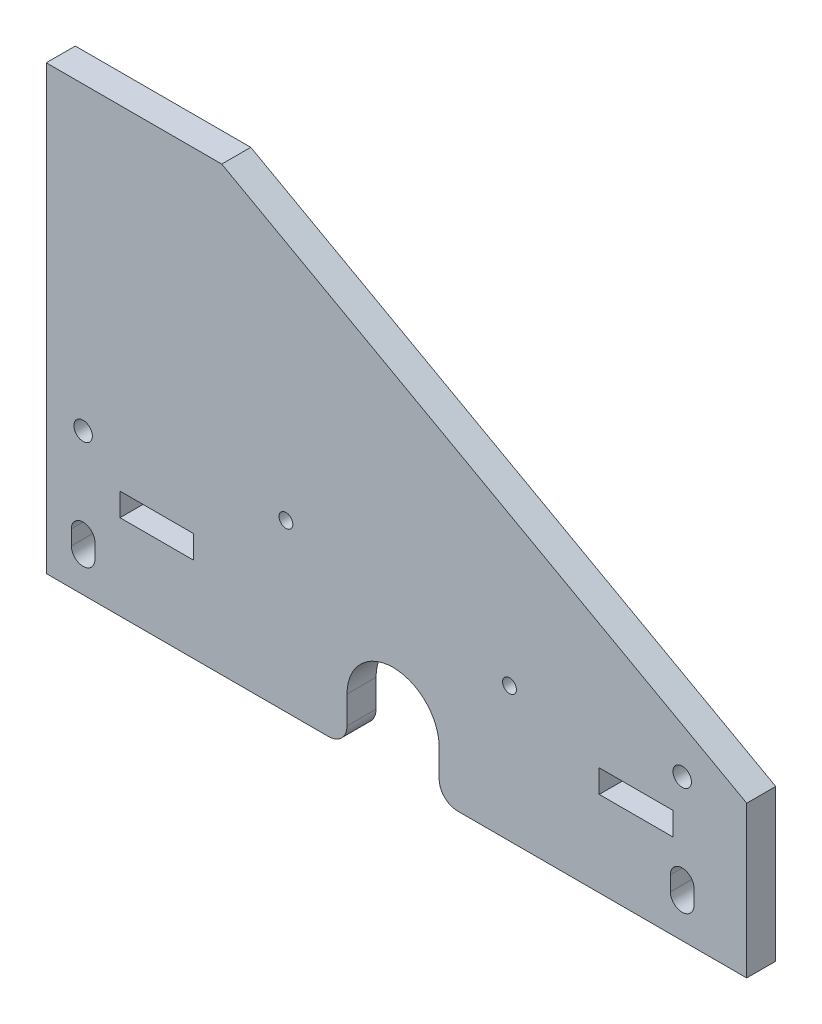
from build123d import *

# Parameters (mm, degrees)
BOSS_EXTRUDE1_DEPTH = 10
CUT_EXTRUDE1_REACH  = 241.572
SKETCH3_W           = 25.4
SKETCH3_H           = 7.9375
CUT_EXTRUDE2_REACH  = 241.572
SKETCH6_R           = 3.175
CUT_EXTRUDE3_DEPTH  = 10
SKETCH7_R           = 2.38125
CUT_EXTRUDE4_DEPTH  = 10
SKETCH8_R           = 2.38125
CUT_EXTRUDE5_DEPTH  = 10
SKETCH9_W           = 25.4
SKETCH9_H           = 7.9375
CUT_EXTRUDE6_DEPTH  = 10
LPATTERN1_COUNT     = 2
LPATTERN1_PITCH     = 206.375
LPATTERN4_COUNT     = 2
LPATTERN4_PITCH     = 206.375
CUT_EXTRUDE7_DEPTH  = 10


with BuildPart() as part:
    # Sketch1 → Boss-Extrude1 (new body)
    with BuildSketch(Plane.XY):
        Polygon((-141.926632071, 127.818083413), (38.921367929, 27.572400076), (38.921367929, -24.581916587), (-202.378632071, -24.581916587), (-202.378632071, 127.818083413), align=None)
    extrude(amount=BOSS_EXTRUDE1_DEPTH)

    # Sketch3 → Cut-Extrude1 (cut, up to next)
    with BuildSketch(Plane.XY.offset(10), mode=Mode.PRIVATE) as cut_extrude1_sk1:
        with Locations((-164.278632071, 8.756853413)):
            Rectangle(SKETCH3_W, SKETCH3_H)
    cut_extrude1_tool1 = extrude(cut_extrude1_sk1.sketch, amount=-CUT_EXTRUDE1_REACH, mode=Mode.PRIVATE) & part.part
    add(cut_extrude1_tool1.solids().sort_by_distance((-164.278632, 8.756853, 10))[0], mode=Mode.SUBTRACT)

    # Sketch4 → Cut-Extrude2 (cut, up to next)
    with BuildSketch(Plane.XY.offset(10), mode=Mode.PRIVATE) as cut_extrude2_sk1:
        with BuildLine():
            Line((-185.614632071, -6.928916587), (-185.614632071, -12.008916587))
            ThreePointArc((-185.614632071, -12.008916587), (-189.678632071, -16.072916587), (-193.742632071, -12.008916587))
            Line((-193.742632071, -12.008916587), (-193.742632071, -6.928916587))
            ThreePointArc((-193.742632071, -6.928916587), (-189.678632071, -2.864916587), (-185.614632071, -6.928916587))
        make_face()
    cut_extrude2_tool1 = extrude(cut_extrude2_sk1.sketch, amount=-CUT_EXTRUDE2_REACH, mode=Mode.PRIVATE) & part.part
    cut_extrude2 = cut_extrude2_tool1.solids().sort_by_distance((-189.678632, -9.468917, 10))[0]
    add(cut_extrude2, mode=Mode.SUBTRACT)

    # Sketch6 → Cut-Extrude3 (cut)
    with BuildSketch(Plane.XY.offset(10)):
        with Locations((-189.678632071, 24.358803413)):
            Circle(SKETCH6_R)
    cut_extrude3 = extrude(amount=-CUT_EXTRUDE3_DEPTH, mode=Mode.SUBTRACT)

    # Sketch7 → Cut-Extrude4 (cut)
    with BuildSketch(Plane.XY.offset(10)):
        with Locations((-119.828632071, 32.568083413)):
            Circle(SKETCH7_R)
    extrude(amount=-CUT_EXTRUDE4_DEPTH, mode=Mode.SUBTRACT)

    # Sketch8 → Cut-Extrude5 (cut)
    with BuildSketch(Plane.XY.offset(10)):
        with Locations((-42.792972071, 21.773083413)):
            Circle(SKETCH8_R)
    extrude(amount=-CUT_EXTRUDE5_DEPTH, mode=Mode.SUBTRACT)

    # Sketch9 → Cut-Extrude6 (cut)
    with BuildSketch(Plane.XY.offset(10)):
        with Locations((0.821367929, 8.756853413)):
            Rectangle(SKETCH9_W, SKETCH9_H)
    extrude(amount=-CUT_EXTRUDE6_DEPTH, mode=Mode.SUBTRACT)

    # LPattern1: Cut-Extrude2 ×2
    with Locations(*[(i * LPATTERN1_PITCH, 0, 0) for i in range(1, LPATTERN1_COUNT)]):
        add(cut_extrude2, mode=Mode.SUBTRACT)

    # LPattern4: Cut-Extrude3 ×2
    with Locations(*[(i * LPATTERN4_PITCH, 0, 0) for i in range(1, LPATTERN4_COUNT)]):
        add(cut_extrude3, mode=Mode.SUBTRACT)

    # Sketch11 → Cut-Extrude7 (cut)
    with BuildSketch(Plane.XY.offset(10)):
        with BuildLine():
            Line((-98.769492071, -8.706916587), (-98.769492071, -18.231916587))
            ThreePointArc((-98.769492071, -18.231916587), (-100.62936401, -22.722044648), (-105.119492071, -24.581916587))
            Line((-105.119492071, -24.581916587), (-60.669492071, -24.581916587))
            ThreePointArc((-60.669492071, -24.581916587), (-65.159620131, -22.722044648), (-67.019492071, -18.231916587))
            Line((-67.019492071, -18.231916587), (-67.019492071, -8.706916587))
            ThreePointArc((-67.019492071, -8.706916587), (-82.894492071, 7.168083413), (-98.769492071, -8.706916587))
        make_face()
    extrude(amount=-CUT_EXTRUDE7_DEPTH, mode=Mode.SUBTRACT)


solid = part.part
